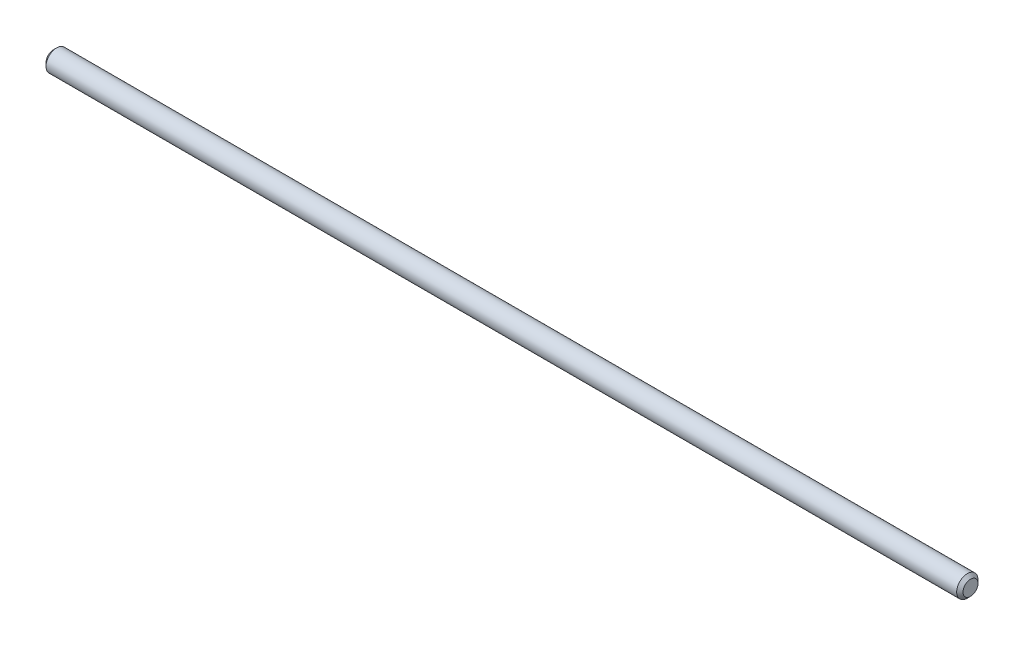
from build123d import *

# Parameters (mm, degrees)
BOSS_EXTRUDE1_DEPTH      = 136.525
BOSS_EXTRUDE1_DEPTH_BACK = 136.525
SKETCH2_R                = 3.175
CHAMFER1_SIZE            = 0.9525


with BuildPart() as part:
    # Sketch2 → Boss-Extrude1 (new, two sides: drawn at the far end of the back side and taken through both)
    with BuildSketch(Plane(origin=(0, 0, 0), x_dir=(0, 0, -1), z_dir=(1, 0, 0)).offset(-BOSS_EXTRUDE1_DEPTH_BACK)):
        Circle(SKETCH2_R)
    extrude(amount=BOSS_EXTRUDE1_DEPTH + BOSS_EXTRUDE1_DEPTH_BACK)

    # Chamfer1
    chamfer1_edges = [part.edges().sort_by_distance(p)[0] for p in [
        (-136.525, 0, 3.175),
        (136.525, 0, 3.175),
    ]]
    chamfer(chamfer1_edges, length=CHAMFER1_SIZE)


solid = part.part
